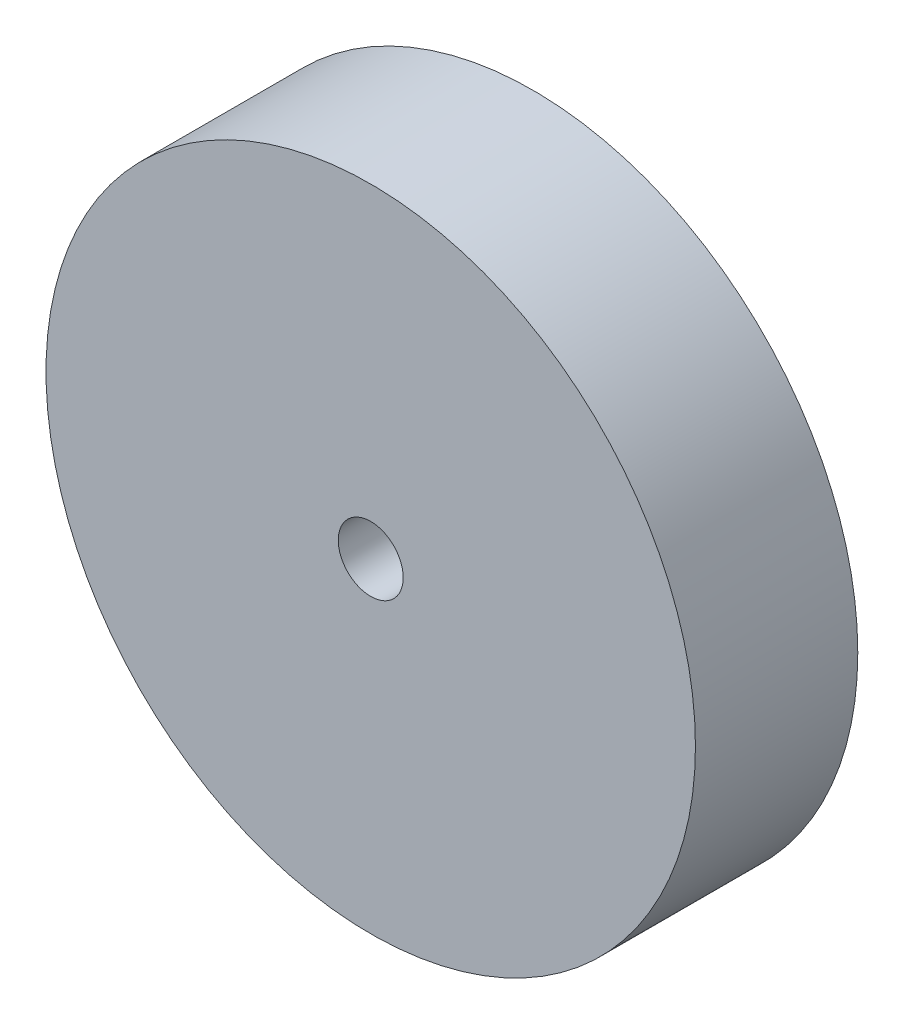
from build123d import *

# Parameters (mm, degrees)
SKETCH1_R           = 100
BOSS_EXTRUDE1_DEPTH = 50
SKETCH2_R           = 10
CUT_EXTRUDE1_DEPTH  = 50


with BuildPart() as part:
    # Sketch1 → Boss-Extrude1 (new body)
    with BuildSketch(Plane.XY):
        Circle(SKETCH1_R)
    extrude(amount=BOSS_EXTRUDE1_DEPTH)

    # Sketch2 → Cut-Extrude1 (cut)
    with BuildSketch(Plane.XY):
        Circle(SKETCH2_R)
    extrude(amount=CUT_EXTRUDE1_DEPTH, mode=Mode.SUBTRACT)


solid = part.part
